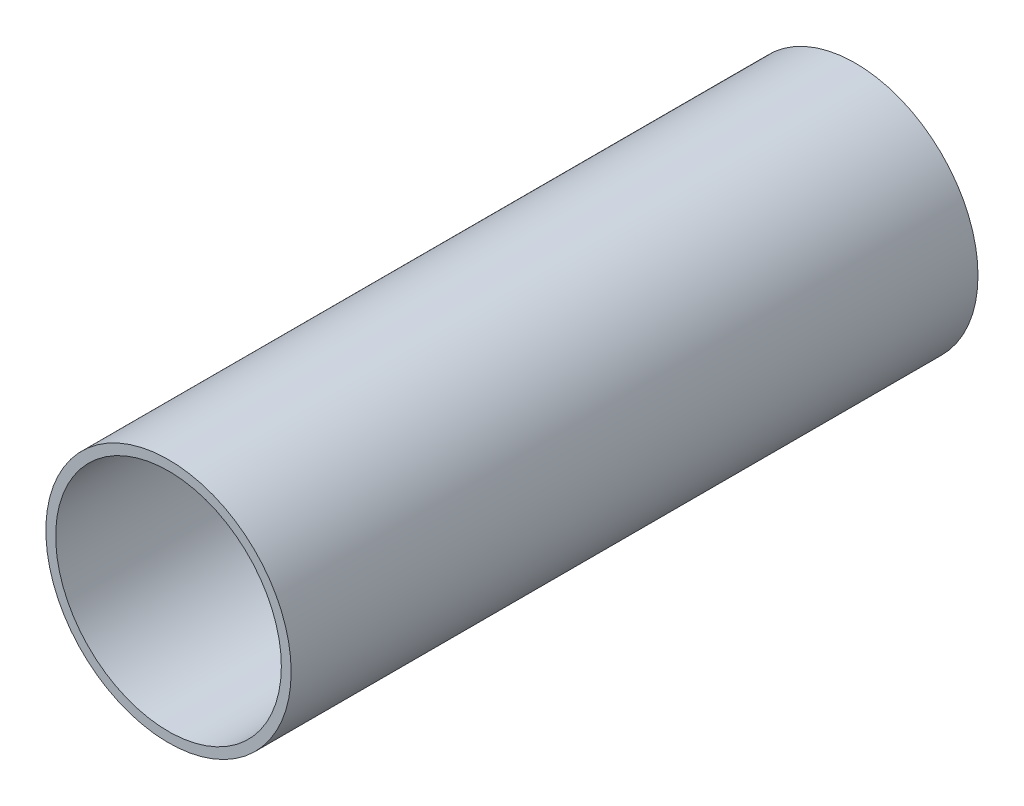
from build123d import *

# Parameters (mm, degrees)
BOSS_EXTRUDE1_DEPTH      = 40
BOSS_EXTRUDE1_DEPTH_BACK = 100
SKETCH1_R                = 25
SKETCH1_R_2              = 23


with BuildPart() as part:
    # Sketch1 → Boss-Extrude1 (new, two sides: drawn at the far end of the back side and taken through both)
    with BuildSketch(Plane.XY.offset(-BOSS_EXTRUDE1_DEPTH_BACK)):
        Circle(SKETCH1_R)
        Circle(SKETCH1_R_2, mode=Mode.SUBTRACT)
    extrude(amount=BOSS_EXTRUDE1_DEPTH + BOSS_EXTRUDE1_DEPTH_BACK)


solid = part.part
